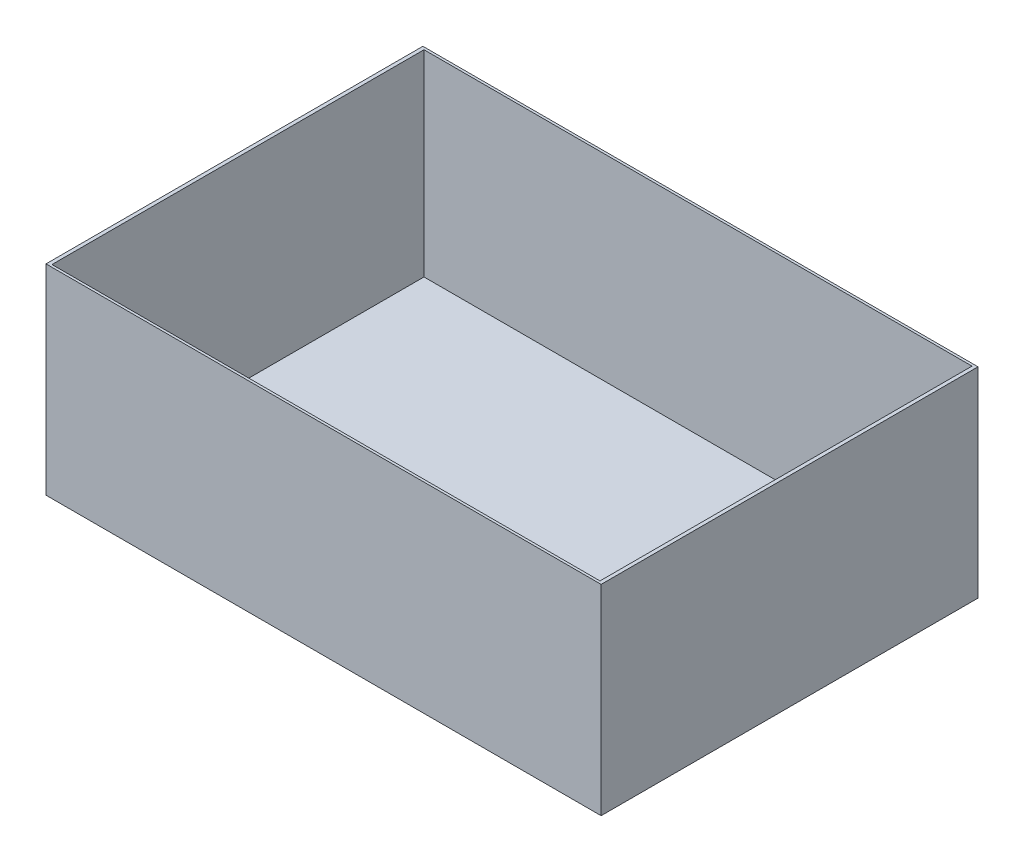
from build123d import *

# Parameters (mm, degrees)
SKETCH1_W           = 498.44
SKETCH1_H           = 338.38
BOSS_EXTRUDE1_DEPTH = 3.2
SKETCH2_W           = 498.44
SKETCH2_H           = 338.38
SKETCH2_W_2         = 492.04
SKETCH2_H_2         = 334.035180162
BOSS_EXTRUDE2_DEPTH = 176.7


with BuildPart() as part:
    # Sketch1 → Boss-Extrude1 (new body)
    with BuildSketch(Plane(origin=(0, 0, 0), x_dir=(1, 0, 0), z_dir=(0, 1, 0))):
        Rectangle(SKETCH1_W, SKETCH1_H)
    extrude(amount=BOSS_EXTRUDE1_DEPTH)

    # Sketch2 → Boss-Extrude2 (add)
    with BuildSketch(Plane(origin=(0, 3.2, 0), x_dir=(1, 0, 0), z_dir=(0, 1, 0))):
        Rectangle(SKETCH2_W, SKETCH2_H)
        Rectangle(SKETCH2_W_2, SKETCH2_H_2, mode=Mode.SUBTRACT)
    extrude(amount=BOSS_EXTRUDE2_DEPTH)


solid = part.part
